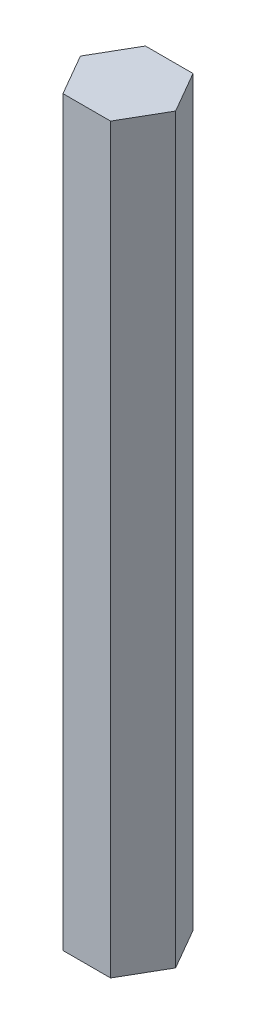
from build123d import *

# Parameters (mm, degrees)
BOSS_EXTRUDE1_DEPTH = 114.3


with BuildPart() as part:
    # Sketch1 → Boss-Extrude1 (new body)
    with BuildSketch(Plane(origin=(0, 0, 0), x_dir=(1, 0, 0), z_dir=(0, 1, 0))):
        Polygon((3.666174209, 6.35), (-3.666174209, 6.35), (-7.332348419, 0), (-3.666174209, -6.35), (3.666174209, -6.35), (7.332348419, 0), align=None)
    extrude(amount=BOSS_EXTRUDE1_DEPTH)


solid = part.part
